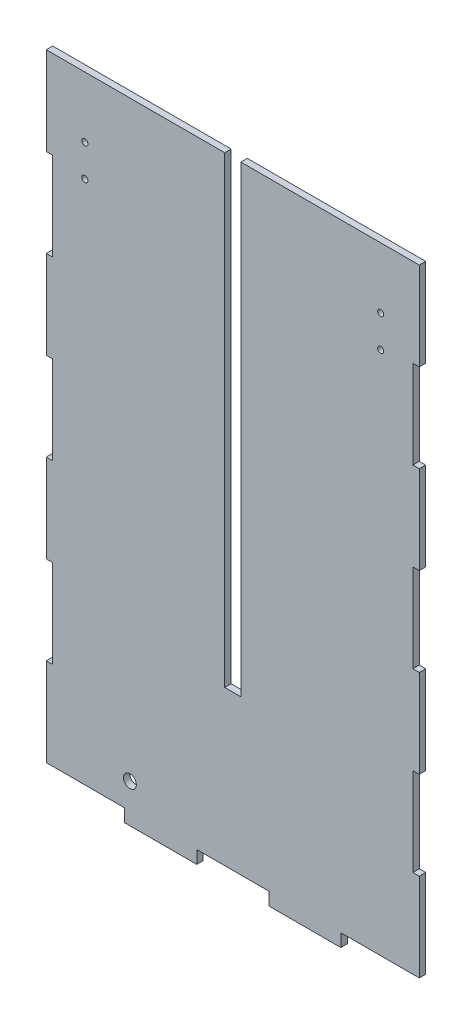
from build123d import *

# Parameters (mm, degrees)
BOSS_EXTRUDE1_DEPTH = 3.175
SKETCH3_W           = 7.9375
SKETCH3_H           = 228.6
CUT_EXTRUDE1_DEPTH  = 184.546857096
SKETCH4_R           = 3.175
CUT_EXTRUDE2_DEPTH  = 184.546857096
SKETCH5_R           = 1.5
CUT_EXTRUDE3_DEPTH  = 3.175


with BuildPart() as part:
    # Sketch2 → Boss-Extrude1 (new body)
    with BuildSketch(Plane.XY):
        Polygon((-92.075, 152.4), (-92.075, 108.857142857), (-88.9, 108.857142857), (-88.9, 65.314285714), (-92.075, 65.314285714), (-92.075, 21.771428571), (-88.9, 21.771428571), (-88.9, -21.771428571), (-92.075, -21.771428571), (-92.075, -65.314285714), (-88.9, -65.314285714), (-88.9, -108.857142857), (-92.075, -108.857142857), (-92.075, -152.4), (-53.34, -152.4), (-53.34, -158.75), (-17.78, -158.75), (-17.78, -152.4), (17.78, -152.4), (17.78, -158.75), (53.34, -158.75), (53.34, -152.4), (92.075, -152.4), (92.075, -108.857142857), (88.9, -108.857142857), (88.9, -65.314285714), (92.075, -65.314285714), (92.075, -21.771428571), (88.9, -21.771428571), (88.9, 21.771428571), (92.075, 21.771428571), (92.075, 65.314285714), (88.9, 65.314285714), (88.9, 108.857142857), (92.075, 108.857142857), (92.075, 152.4), align=None)
    extrude(amount=BOSS_EXTRUDE1_DEPTH)

    # Sketch3 → Cut-Extrude1 (cut, through all)
    with BuildSketch(Plane.XY.offset(3.175)):
        with Locations((0, 38.1)):
            Rectangle(SKETCH3_W, SKETCH3_H)
    extrude(amount=-CUT_EXTRUDE1_DEPTH, mode=Mode.SUBTRACT)

    # Sketch4 → Cut-Extrude2 (cut, through all)
    with BuildSketch(Plane.XY.offset(3.175)):
        with Locations((-50.8, -139.7)):
            Circle(SKETCH4_R)
    extrude(amount=-CUT_EXTRUDE2_DEPTH, mode=Mode.SUBTRACT)

    # Sketch5 → Cut-Extrude3 (cut)
    with BuildSketch(Plane.XY.offset(3.175)):
        with Locations((-73.025, 122.4)):
            Circle(SKETCH5_R)
        with Locations((-73.025, 106.65)):
            Circle(SKETCH5_R)
        with Locations((73.025, 122.4)):
            Circle(SKETCH5_R)
        with Locations((73.025, 106.65)):
            Circle(SKETCH5_R)
    extrude(amount=-CUT_EXTRUDE3_DEPTH, mode=Mode.SUBTRACT)


solid = part.part
